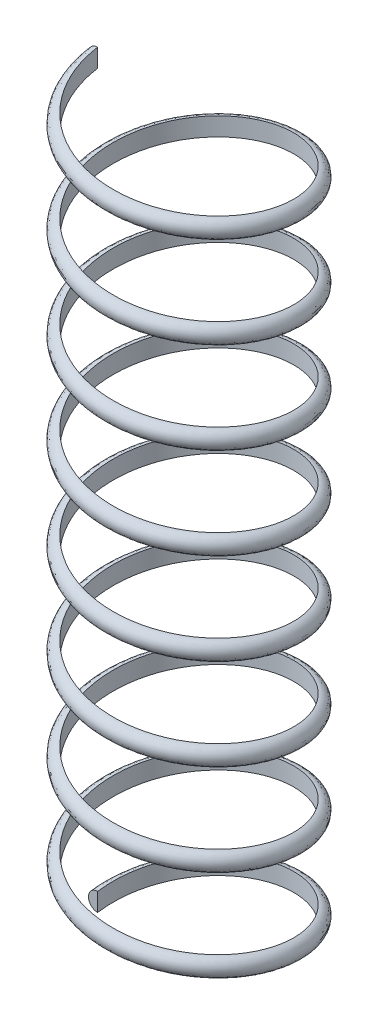
from build123d import *

# Parameters (mm, degrees)
SWEEP1_PITCH       = 31.75
SWEEP1_HEIGHT      = 254
SWEEP1_RADIUS      = 31.75
SWEEP1_START_ANGLE = -90
SKETCH3_R          = 3.175
SKETCH4_R          = 31.75
CUT_EXTRUDE4_DEPTH = 279.4


with BuildPart() as part:
    # Sweep1: sweep along a helix
    with BuildLine() as sweep1_path:
        add(Helix(SWEEP1_PITCH, SWEEP1_HEIGHT, SWEEP1_RADIUS, center=(0, 0, 0), direction=(0, 1, 0), lefthand=True, mode=Mode.PRIVATE).rotate(Axis((0, 0, 0), (0, 1, 0)), SWEEP1_START_ANGLE))
    # Sketch3 → Sweep1 (sweep)
    with BuildSketch(Plane.XY):
        with Locations((-31.75, 0)):
            Circle(SKETCH3_R)
    sweep(path=sweep1_path.line, is_frenet=True)

    # Sketch4 → Cut-Extrude4 (cut, symmetric)
    with BuildSketch(Plane(origin=(0, 0, 0), x_dir=(1, 0, 0), z_dir=(0, 1, 0))):
        Circle(SKETCH4_R)
    extrude(amount=CUT_EXTRUDE4_DEPTH, both=True, mode=Mode.SUBTRACT)


solid = part.part
